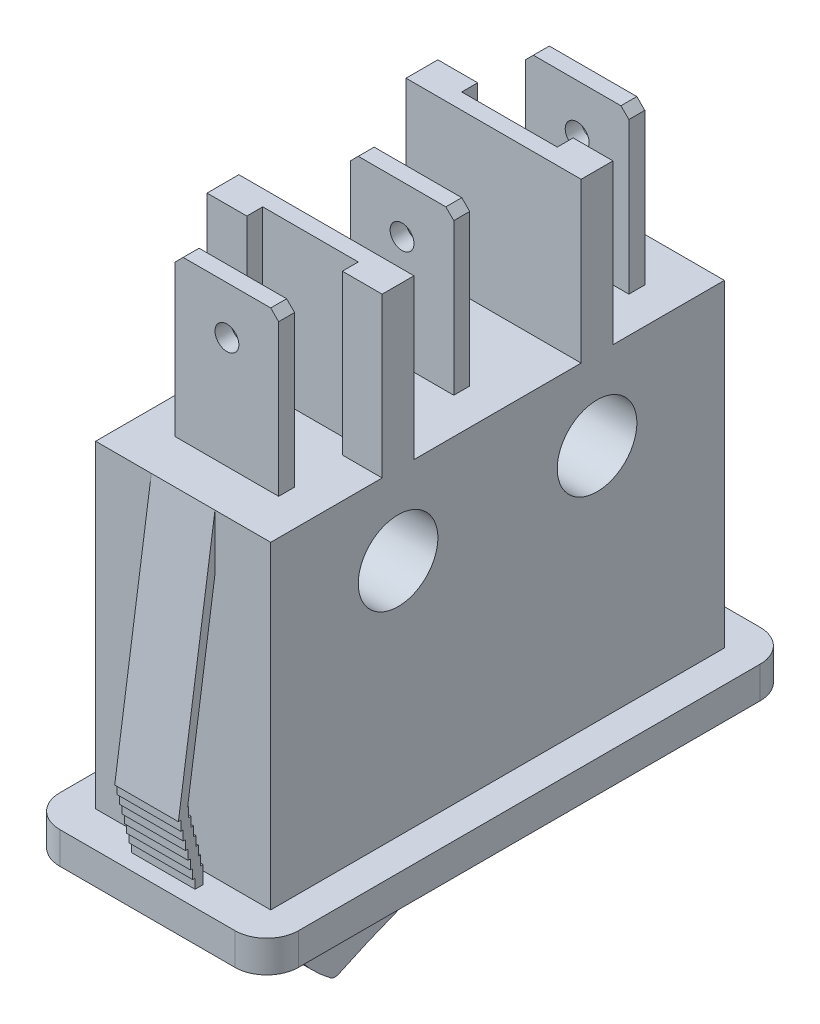
from build123d import *

# Parameters (mm, degrees)
SKETCH_1_W           = 11
SKETCH_1_H           = 28.5
EXTRUDE_1_DEPTH      = 20
EXTRUDE_2_DEPTH      = 2
SKETCH_10_W          = 6.5
SKETCH_10_H          = 1
EXTRUDE_10_DEPTH     = 10
SKETCH_11_R          = 0.75
CUT_EXTRUDE_11_DEPTH = 42.716303767
EXTRUDE_3_DEPTH      = 10
EXTRUDE_4_DEPTH      = 4
SKETCH_15_W          = 3.5
SKETCH_15_H          = 20
CUT_EXTRUDE_16_DEPTH = 44.60977528
SKETCH_5_W           = 9
SKETCH_5_H           = 27
CUT_EXTRUDE_5_DEPTH  = 5
EXTRUDE_6_DEPTH      = 4.25
CUT_EXTRUDE_7_DEPTH  = 5
CUT_EXTRUDE_9_DEPTH  = 0.25
CHAMFER_1_SIZE       = 0.5
SKETCH_12_R          = 2.5
CUT_EXTRUDE_12_DEPTH = 37.645634119


with BuildPart() as part:
    # Эскиз1 → Вытянуть1 (new body)
    with BuildSketch(Plane(origin=(0, 0, 0), x_dir=(1, 0, 0), z_dir=(0, 1, 0))):
        Rectangle(SKETCH_1_W, SKETCH_1_H)
    extrude(amount=EXTRUDE_1_DEPTH)

    # Эскиз2 → Вытянуть2 (add)
    with BuildSketch(Plane.XZ):
        with BuildLine():
            Line((-5.5, 16.5), (5.5, 16.5))
            ThreePointArc((5.5, 16.5), (6.914213562, 15.914213562), (7.5, 14.5))
            Line((7.5, 14.5), (7.5, -14.5))
            ThreePointArc((7.5, -14.5), (6.914213562, -15.914213562), (5.5, -16.5))
            Line((5.5, -16.5), (-5.5, -16.5))
            ThreePointArc((-5.5, -16.5), (-6.914213562, -15.914213562), (-7.5, -14.5))
            Line((-7.5, -14.5), (-7.5, 14.5))
            ThreePointArc((-7.5, 14.5), (-6.914213562, 15.914213562), (-5.5, 16.5))
        make_face()
    extrude(amount=EXTRUDE_2_DEPTH)

    # Эскиз10 → Вытянуть10 (add)
    with BuildSketch(Plane(origin=(0, 20, 0), x_dir=(1, 0, 0), z_dir=(0, 1, 0))):
        Rectangle(SKETCH_10_W, SKETCH_10_H)
        with Locations((0, 11)):
            Rectangle(SKETCH_10_W, SKETCH_10_H)
        with Locations((0, -11)):
            Rectangle(SKETCH_10_W, SKETCH_10_H)
    extrude(amount=EXTRUDE_10_DEPTH)

    # Эскиз11 → Вытянуть11 (cut, through all)
    with BuildSketch(Plane.XY.offset(11.5)):
        with Locations((0, 27)):
            Circle(SKETCH_11_R)
    extrude(amount=-CUT_EXTRUDE_11_DEPTH, mode=Mode.SUBTRACT)

    # Эскиз3 → Вытянуть3 (add)
    with BuildSketch(Plane(origin=(0, 20, 0), x_dir=(1, 0, 0), z_dir=(0, 1, 0))):
        Polygon((-5.5, 5.25), (5.5, 5.25), (5.5, 7.25), (3, 7.25), (3, 6.25), (-3, 6.25), (-3, 7.25), (-5.5, 7.25), align=None)
    extrude_3 = extrude(amount=EXTRUDE_3_DEPTH)

    # Эскиз4 → Вытянуть4 (add, symmetric)
    with BuildSketch(Plane(origin=(0, 0, 0), x_dir=(0, 0, -1), z_dir=(1, 0, 0))):
        Polygon((14.25, 20), (16.55, 4.2), (16.4, 4.2), (16.4, 3.6), (16.25, 3.6), (16.25, 3), (16.1, 3), (16.1, 2.4), (15.95, 2.4), (15.95, 1.8), (15.8, 1.8), (15.8, 1.2), (15.65, 1.2), (15.65, 0.6), (15.5, 0.6), (15.5, 0), (15, 0), (15, 1.1), (15.15, 1.1), (15.15, 1.7), (15.3, 1.7), (15.3, 2.3), (15.45, 2.3), (15.45, 2.9), (15.6, 2.9), (15.6, 3.5), (15.75, 3.5), (15.75, 4.1), (15.9, 4.1), (15.9, 4.7), (15.971945333, 4.7), (13.755214894, 19.92797432), align=None)
    extrude_4 = extrude(amount=EXTRUDE_4_DEPTH, both=True)

    # Эскиз15 → Вытянуть16 (cut, through all)
    with BuildSketch(Plane(origin=(0, 0, -14.25), x_dir=(-1, 0, 0), z_dir=(0, 0, -1))):
        with Locations((-3.75, 10)):
            Rectangle(SKETCH_15_W, SKETCH_15_H)
        with Locations((3.75, 10)):
            Rectangle(SKETCH_15_W, SKETCH_15_H)
    cut_extrude_16 = extrude(amount=CUT_EXTRUDE_16_DEPTH, mode=Mode.SUBTRACT)

    # Зеркальное отражение1: Вытянуть3, Вытянуть4, Вытянуть16 across plane
    add(extrude_3.mirror(Plane.XY))
    add(extrude_4.mirror(Plane.XY))
    add(cut_extrude_16.mirror(Plane.XY), mode=Mode.SUBTRACT)

    # Эскиз5 → Вытянуть5 (cut)
    with BuildSketch(Plane.XZ.offset(2)):
        Rectangle(SKETCH_5_W, SKETCH_5_H)
    extrude(amount=-CUT_EXTRUDE_5_DEPTH, mode=Mode.SUBTRACT)

    # Эскиз6 → Вытянуть6 (add, symmetric)
    with BuildSketch(Plane(origin=(0, 0, 0), x_dir=(0, 0, -1), z_dir=(1, 0, 0))):
        with BuildLine():
            Line((-13.1, 3), (13.1, 3))
            ThreePointArc((13.1, 3), (13.275157251, 0.669623016), (12.904664572, -1.63777208))
            ThreePointArc((12.904664572, -1.63777208), (12.726586724, -1.899128682), (12.427304013, -2.001348308))
            ThreePointArc((12.427304013, -2.001348308), (1.579548627, -3.273980419), (-8.733059186, -6.871689341))
            ThreePointArc((-8.733059186, -6.871689341), (-8.997313848, -6.918001498), (-9.247467354, -6.821055296))
            ThreePointArc((-9.247467354, -6.821055296), (-12.574179953, -2.4598846), (-13.1, 3))
        make_face()
    extrude(amount=EXTRUDE_6_DEPTH, both=True)

    # Эскиз7 → Вытянуть7 (cut)
    with BuildSketch(Plane.XZ.offset(7)):
        with BuildLine():
            add(Edge.make_bspline(
                [(-1.055555556, -9.275824653), (-1.054853121, -9.227205531), (-1.053473019, -9.131681649), (-1.046141232, -8.991000493), (-1.032564865, -8.855370892), (-1.012626567, -8.725198639), (-0.988415287, -8.599936016), (-0.959141181, -8.479829503), (-0.923236572, -8.365067235), (-0.882468009, -8.255732505), (-0.836460169, -8.152702619), (-0.788757267, -8.05504387), (-0.734789285, -7.96540482), (-0.679098264, -7.881820954), (-0.619682116, -7.804924757), (-0.555320773, -7.736217322), (-0.489148987, -7.672192954), (-0.440714951, -7.635745255), (-0.416775174, -7.617730035)],
                knots=[0, 0, 0, 0, 1.267948223, 2.491187271, 3.672419621, 4.820944812, 5.924168987, 6.998668076, 8.042818115, 9.058224754, 10.039662809, 10.984530588, 11.890392543, 12.765710998, 13.603053422, 14.420720048, 15.219399938, 16, 16, 16, 16], degree=3))
            add(Edge.make_bspline(
                [(-0.416775174, -7.617730035), (-0.379775942, -7.592172517), (-0.308207961, -7.542736357), (-0.191453126, -7.490906259), (-0.073262236, -7.457764084), (0.006843558, -7.453501646), (0.046549479, -7.451388889)],
                knots=[0, 0, 0, 0, 1.076116545, 2.081542914, 3.049081206, 4, 4, 4, 4], degree=3))
            add(Edge.make_bspline(
                [(0.046549479, -7.451388889), (0.078800804, -7.452474049), (0.142863274, -7.454629558), (0.237420722, -7.474597711), (0.329349601, -7.506711845), (0.418457978, -7.552058714), (0.505071252, -7.609711562), (0.588737896, -7.680348327), (0.670259029, -7.763163791), (0.719824711, -7.825609214), (0.745334201, -7.857747396)],
                knots=[0, 0, 0, 0, 0.921550053, 1.830522441, 2.751246923, 3.70019056, 4.682375705, 5.720881843, 6.827028318, 8, 8, 8, 8], degree=3))
            add(Edge.make_bspline(
                [(0.745334201, -7.857747396), (0.776317921, -7.90098648), (0.838875316, -7.988287954), (0.918119315, -8.131514418), (0.983526175, -8.286442333), (1.03888513, -8.451813953), (1.079791425, -8.628720619), (1.11031577, -8.816440957), (1.128630731, -9.015442112), (1.130822236, -9.151979632), (1.131944444, -9.221896701)],
                knots=[0, 0, 0, 0, 0.883963831, 1.784759013, 2.714530965, 3.677036329, 4.680787027, 5.730006124, 6.837599228, 8, 8, 8, 8], degree=3))
            add(Edge.make_bspline(
                [(1.131944444, -9.221896701), (1.131682112, -9.271283953), (1.131167803, -9.368108568), (1.12196581, -9.510437073), (1.109992255, -9.647169213), (1.090290192, -9.778029806), (1.067519186, -9.90375567), (1.037390447, -10.023439043), (1.00390086, -10.137938195), (0.963148176, -10.245568813), (0.919282187, -10.346818783), (0.873197569, -10.441832854), (0.822742613, -10.528913849), (0.770733746, -10.609819269), (0.715204344, -10.683036962), (0.656401733, -10.748694857), (0.594816173, -10.807555062), (0.53034157, -10.858786245), (0.465257315, -10.903563077), (0.400061063, -10.941708437), (0.335801862, -10.974613626), (0.271650172, -11.001017839), (0.208755717, -11.023029344), (0.145984407, -11.036956863), (0.084083459, -11.046911923), (0.042790777, -11.048046537), (0.022243924, -11.048611111)],
                knots=[0, 0, 0, 0, 1.510050896, 2.960482548, 4.360412811, 5.706191847, 7.006128856, 8.266230485, 9.478809624, 10.652394328, 11.782968825, 12.852979618, 13.879641343, 14.858961868, 15.792780312, 16.68657793, 17.551917979, 18.394760493, 19.202293251, 19.965865945, 20.70343888, 21.408045917, 22.086293389, 22.738035093, 23.372058038, 24, 24, 24, 24], degree=3))
            add(Edge.make_bspline(
                [(0.022243924, -11.048611111), (-0.017421441, -11.046922552), (-0.095947624, -11.043579683), (-0.210809412, -11.014749589), (-0.320803286, -10.969019081), (-0.424626094, -10.903072686), (-0.523445731, -10.819840335), (-0.617192955, -10.718549794), (-0.705319522, -10.598744343), (-0.756886094, -10.509865916), (-0.783637153, -10.463758681)],
                knots=[0, 0, 0, 0, 0.907345466, 1.796286953, 2.695609492, 3.62566933, 4.601329434, 5.647644493, 6.779674527, 8, 8, 8, 8], degree=3))
            add(Edge.make_bspline(
                [(-0.783637153, -10.463758681), (-0.805554519, -10.422042345), (-0.849810107, -10.337808637), (-0.904757619, -10.204545049), (-0.95129539, -10.064910461), (-0.988681784, -9.919073546), (-1.019671223, -9.767357738), (-1.040585818, -9.609250509), (-1.052663937, -9.444634761), (-1.054579412, -9.332811045), (-1.055555556, -9.275824653)],
                knots=[0, 0, 0, 0, 0.917887123, 1.853399498, 2.805111979, 3.783983157, 4.785434396, 5.820907986, 6.889514713, 8, 8, 8, 8], degree=3))
        make_face()
        with BuildLine():
            add(Edge.make_bspline(
                [(-0.569444444, -9.336588542), (-0.568738419, -9.395585844), (-0.567359116, -9.510843879), (-0.560203697, -9.679367185), (-0.546321304, -9.839466898), (-0.527608086, -9.991284177), (-0.503360819, -10.135001314), (-0.474072609, -10.270522498), (-0.438514177, -10.397521946), (-0.410105214, -10.478326949), (-0.396267361, -10.517686632)],
                knots=[0, 0, 0, 0, 1.180112402, 2.305485676, 3.372849049, 4.393553838, 5.364293091, 6.287088038, 7.165649773, 8, 8, 8, 8], degree=3))
            add(Edge.make_bspline(
                [(-0.396267361, -10.517686632), (-0.384252421, -10.54810892), (-0.361324497, -10.606163297), (-0.318432515, -10.684670838), (-0.272365641, -10.75194278), (-0.22081172, -10.806639769), (-0.165235608, -10.85044943), (-0.103924162, -10.880033573), (-0.038948673, -10.899560654), (0.006150459, -10.901693428), (0.029079861, -10.902777778)],
                knots=[0, 0, 0, 0, 1.27796888, 2.438728037, 3.490730404, 4.457262314, 5.368188585, 6.240469892, 7.105415757, 8, 8, 8, 8], degree=3))
            add(Edge.make_bspline(
                [(0.029079861, -10.902777778), (0.052047125, -10.901262102), (0.099637506, -10.898121477), (0.170600981, -10.872676048), (0.241503933, -10.831788327), (0.300778004, -10.787830453), (0.345975308, -10.743112007), (0.380076673, -10.704511172), (0.409957333, -10.658927769), (0.438800473, -10.609062164), (0.465684155, -10.553815106), (0.489484361, -10.493224145), (0.511946665, -10.427420943), (0.524091262, -10.381307703), (0.530381944, -10.357421875)],
                knots=[0, 0, 0, 0, 1.037825602, 2.150474477, 3.371635047, 4.73778764, 5.475301301, 6.247273825, 7.064217381, 7.93705097, 8.854564737, 9.842063216, 10.882227619, 12, 12, 12, 12], degree=3))
            add(Edge.make_bspline(
                [(0.530381944, -10.357421875), (0.539897463, -10.31851845), (0.559750854, -10.237349477), (0.582556352, -10.108945398), (0.602458365, -9.969373053), (0.617861468, -9.818314241), (0.630959551, -9.655753848), (0.639775237, -9.48199709), (0.645210896, -9.296874538), (0.645621518, -9.169745121), (0.645833333, -9.104166667)],
                knots=[0, 0, 0, 0, 0.761713504, 1.589256053, 2.479498212, 3.443272477, 4.477217009, 5.58167292, 6.752529866, 8, 8, 8, 8], degree=3))
            add(Edge.make_bspline(
                [(0.645833333, -9.104166667), (0.645695444, -9.055294042), (0.645424549, -8.95928036), (0.638764358, -8.818486782), (0.630038353, -8.683960833), (0.617359018, -8.555699053), (0.599644057, -8.433935406), (0.579357059, -8.318075316), (0.555397105, -8.208478557), (0.535531325, -8.13818666), (0.525824653, -8.103841146)],
                knots=[0, 0, 0, 0, 1.160165125, 2.279225349, 3.345596166, 4.360583534, 5.338162882, 6.266121345, 7.152804842, 8, 8, 8, 8], degree=3))
            add(Edge.make_bspline(
                [(0.525824653, -8.103841146), (0.518193473, -8.079968054), (0.503388416, -8.033652479), (0.478278483, -7.967489697), (0.451703873, -7.906640286), (0.423900795, -7.850733406), (0.393195861, -7.800955581), (0.362559636, -7.755464392), (0.328681676, -7.716445318), (0.304471822, -7.693501629), (0.292643229, -7.682291667)],
                knots=[0, 0, 0, 0, 1.233545328, 2.393169741, 3.481419258, 4.501374537, 5.463177041, 6.358578008, 7.198024365, 8, 8, 8, 8], degree=3))
            add(Edge.make_bspline(
                [(0.292643229, -7.682291667), (0.275110225, -7.669158973), (0.240201593, -7.643011466), (0.179317267, -7.616484475), (0.113501495, -7.600097974), (0.06766372, -7.598193932), (0.044270833, -7.597222222)],
                knots=[0, 0, 0, 0, 0.978770933, 1.948756365, 2.953166656, 4, 4, 4, 4], degree=3))
            add(Edge.make_bspline(
                [(0.044270833, -7.597222222), (0.016396455, -7.599095851), (-0.039444677, -7.602849317), (-0.119623681, -7.634649963), (-0.194496215, -7.685551435), (-0.236625721, -7.73119587), (-0.258789062, -7.755208333)],
                knots=[0, 0, 0, 0, 0.945219573, 1.893571615, 2.891857598, 4, 4, 4, 4], degree=3))
            add(Edge.make_bspline(
                [(-0.258789062, -7.755208333), (-0.273618588, -7.774171128), (-0.304002625, -7.813023773), (-0.343362855, -7.878753849), (-0.379975547, -7.951400246), (-0.411394319, -8.032587148), (-0.440148256, -8.12085054), (-0.466376683, -8.216752346), (-0.486855668, -8.3207218), (-0.51089394, -8.46845969), (-0.534498918, -8.657593899), (-0.553411868, -8.885191468), (-0.567718791, -9.111329033), (-0.56887016, -9.261623916), (-0.569444444, -9.336588542)],
                knots=[0, 0, 0, 0, 0.529149883, 1.084168889, 1.682003891, 2.317081463, 2.996986461, 3.723908646, 4.502772949, 5.326906926, 7.016784336, 8.694047759, 10.351045161, 12, 12, 12, 12], degree=3))
        make_face(mode=Mode.SUBTRACT)
    extrude(amount=-CUT_EXTRUDE_7_DEPTH, mode=Mode.SUBTRACT)

    # Эскиз9 → Вытянуть9 (cut, symmetric)
    with BuildSketch(Plane(origin=(0, 0, 0), x_dir=(0, 0, -1), z_dir=(1, 0, 0))):
        with BuildLine():
            Line((-6.818504689, -6.278968053), (-6.996987592, -5.811909328))
            Line((-6.996987592, -5.811909328), (-3.260517786, -4.384046103))
            Line((-3.260517786, -4.384046103), (-3.082034883, -4.851104829))
            ThreePointArc((-3.082034883, -4.851104829), (-4.964625915, -5.527468948), (-6.818504689, -6.278968053))
        make_face()
    extrude(amount=CUT_EXTRUDE_9_DEPTH, both=True, mode=Mode.SUBTRACT)

    # Фаска1
    chamfer_1_edges = [part.edges().sort_by_distance(p)[0] for p in [
        (3.25, 30, 0),
        (-3.25, 30, 0),
        (3.25, 30, -11),
        (-3.25, 30, -11),
        (3.25, 30, 11),
        (-3.25, 30, 11),
    ]]
    chamfer(chamfer_1_edges, length=CHAMFER_1_SIZE)

    # Эскиз12 → Вытянуть12 (cut, through all)
    with BuildSketch(Plane.ZY.offset(5.5)):
        with Locations((-6.25, 15)):
            Circle(SKETCH_12_R)
        with Locations((6.25, 15)):
            Circle(SKETCH_12_R)
    extrude(amount=-CUT_EXTRUDE_12_DEPTH, mode=Mode.SUBTRACT)


solid = part.part
